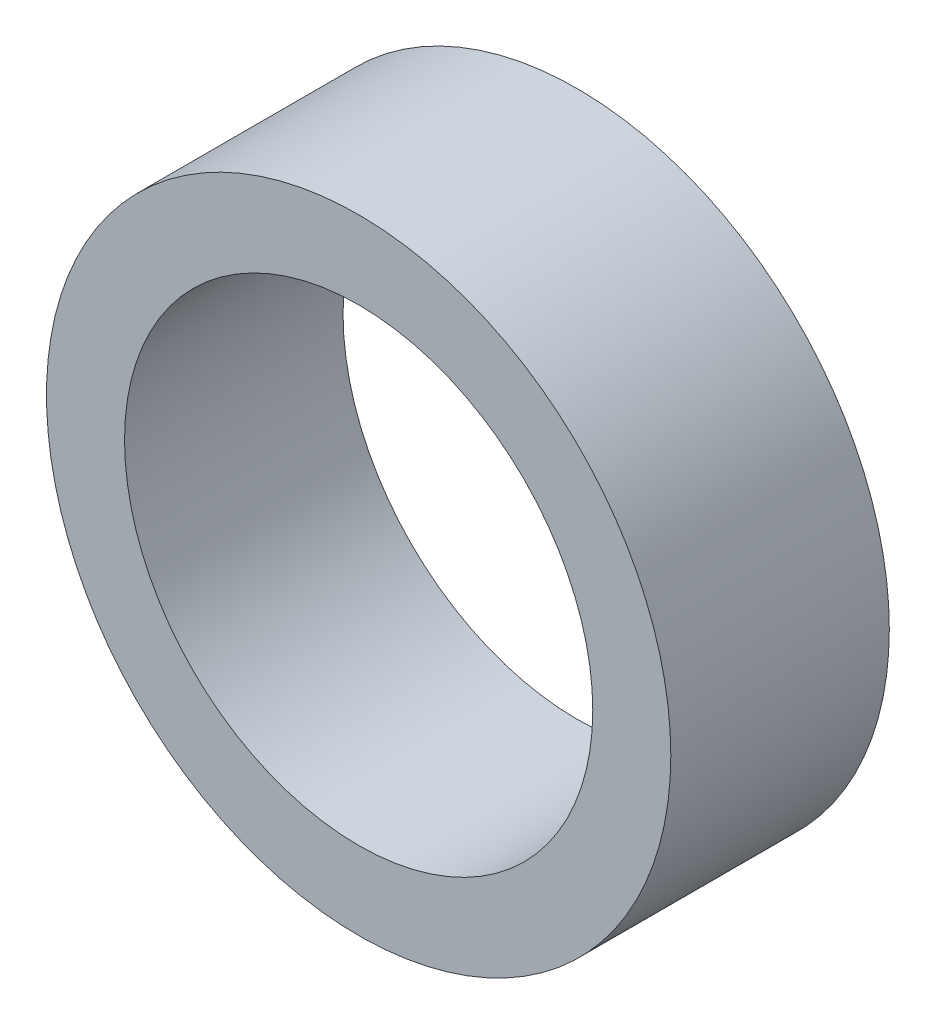
from build123d import *

# Parameters (mm, degrees)
SKETCH1_R           = 4
SKETCH1_R_2         = 3
BOSS_EXTRUDE1_DEPTH = 2.8


with BuildPart() as part:
    # Sketch1 → Boss-Extrude1 (new body)
    with BuildSketch(Plane.XY):
        with Locations((-20, -9.999990176)):
            Circle(SKETCH1_R)
        with Locations((-20, -9.999990176)):
            Circle(SKETCH1_R_2, mode=Mode.SUBTRACT)
    extrude(amount=BOSS_EXTRUDE1_DEPTH)


solid = part.part
